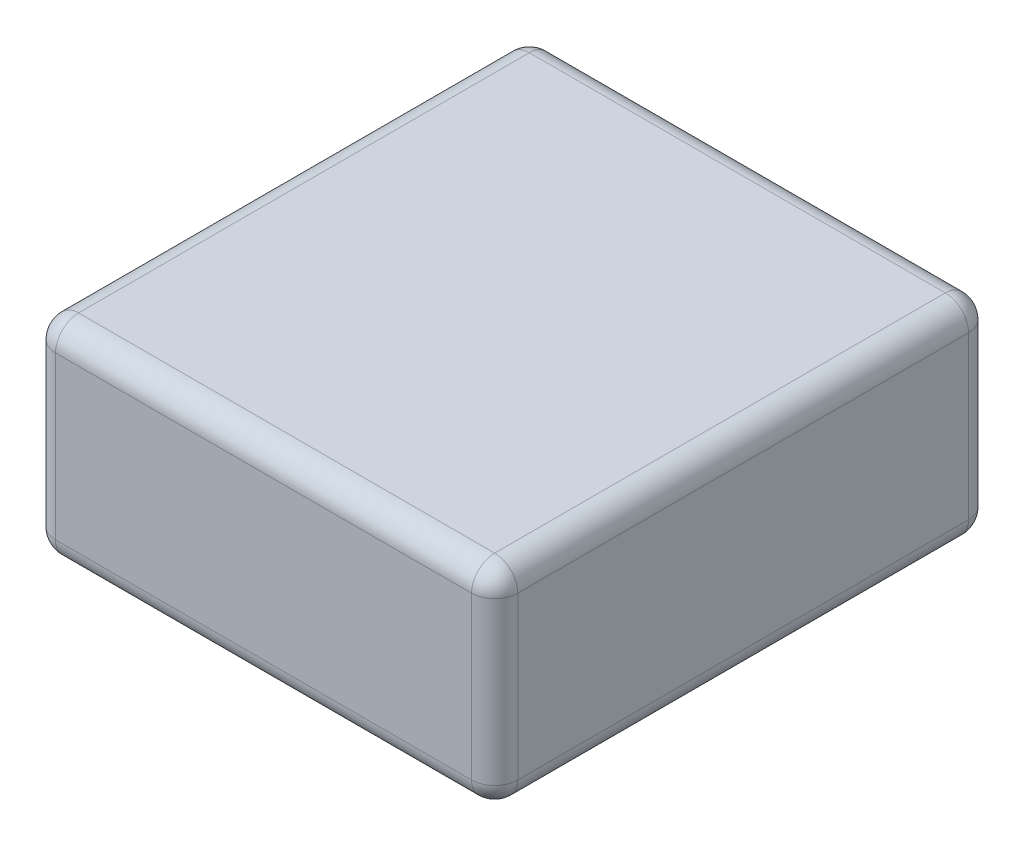
from build123d import *

# Parameters (mm, degrees)
ESQUISSE1_W        = 200
ESQUISSE1_H        = 90
BOSS_EXTRU_1_DEPTH = 215
CONG_1_R           = 10


with BuildPart() as part:
    # Esquisse1 → Boss.-Extru.1 (new body)
    with BuildSketch(Plane.XY):
        Rectangle(ESQUISSE1_W, ESQUISSE1_H)
    extrude(amount=-BOSS_EXTRU_1_DEPTH)

    # Congé1
    cong_1_edges = [part.edges().sort_by_distance(p)[0] for p in [
        (-100, 0, -215),
        (0, -45, -215),
        (100, 0, -215),
        (0, -45, 0),
        (-100, 0, 0),
        (0, 45, 0),
        (100, 0, 0),
        (100, -45, -107.5),
        (-100, -45, -107.5),
        (-100, 45, -107.5),
        (100, 45, -107.5),
        (0, 45, -215),
    ]]
    fillet(cong_1_edges, radius=CONG_1_R)


solid = part.part
